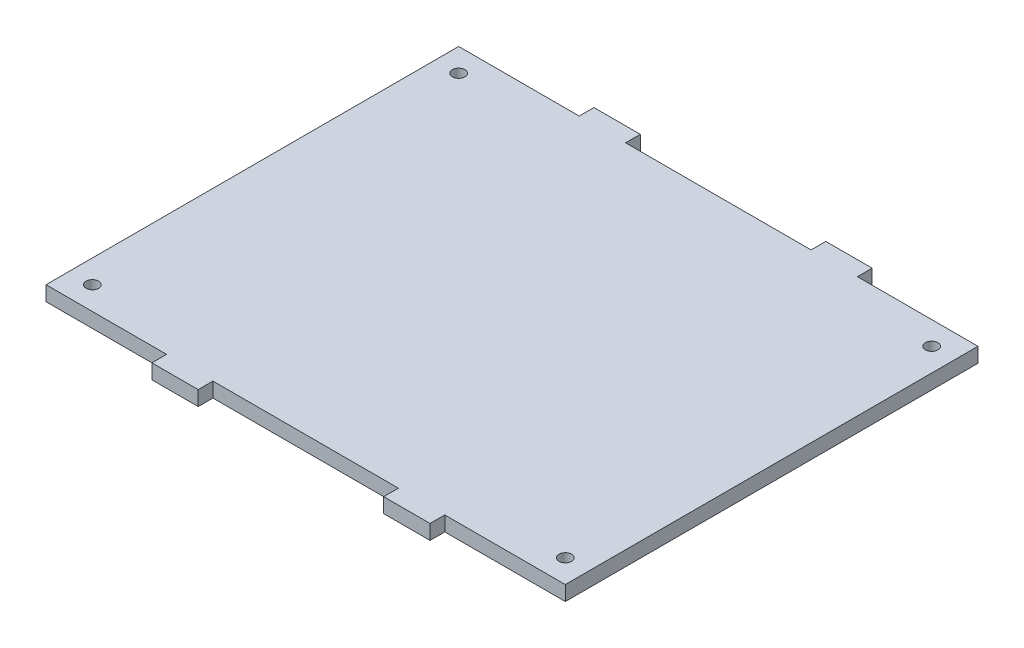
from build123d import *

# Parameters (mm, degrees)
SKETCH1_W           = 112
SKETCH1_H           = 95.35
BOSS_EXTRUDE1_DEPTH = 3.175
SKETCH2_W           = 40
SKETCH2_H           = 3.175
SKETCH2_W_2         = 26
CUT_EXTRUDE1_DEPTH  = 74.613763998
SKETCH3_R           = 1.35
CUT_EXTRUDE2_DEPTH  = 74.613763998


with BuildPart() as part:
    # Sketch1 → Boss-Extrude1 (new body)
    with BuildSketch(Plane(origin=(0, 0, 0), x_dir=(1, 0, 0), z_dir=(0, 1, 0))):
        Rectangle(SKETCH1_W, SKETCH1_H)
    extrude(amount=BOSS_EXTRUDE1_DEPTH)

    # Sketch2 → Cut-Extrude1 (cut, through all)
    with BuildSketch(Plane(origin=(0, 3.175, 0), x_dir=(1, 0, 0), z_dir=(0, 1, 0))):
        with Locations((0, 46.0875)):
            Rectangle(SKETCH2_W, SKETCH2_H)
        with Locations((43, 46.0875)):
            Rectangle(SKETCH2_W_2, SKETCH2_H)
        with Locations((-43, 46.0875)):
            Rectangle(SKETCH2_W_2, SKETCH2_H)
        with Locations((0, -46.0875)):
            Rectangle(SKETCH2_W, SKETCH2_H)
        with Locations((-43, -46.0875)):
            Rectangle(SKETCH2_W_2, SKETCH2_H)
        with Locations((43, -46.0875)):
            Rectangle(SKETCH2_W_2, SKETCH2_H)
    extrude(amount=-CUT_EXTRUDE1_DEPTH, mode=Mode.SUBTRACT)

    # Sketch3 → Cut-Extrude2 (cut, through all)
    with BuildSketch(Plane(origin=(0, 3.175, 0), x_dir=(1, 0, 0), z_dir=(0, 1, 0))):
        with Locations(Location((-51, 39.5, 0), (0, 0, 270))):
            Circle(SKETCH3_R)
        with Locations(Location((51, 39.5, 0), (0, 0, 270))):
            Circle(SKETCH3_R)
        with Locations(Location((-51, -39.5, 0), (0, 0, 270))):
            Circle(SKETCH3_R)
        with Locations(Location((51, -39.5, 0), (0, 0, 270))):
            Circle(SKETCH3_R)
    extrude(amount=-CUT_EXTRUDE2_DEPTH, mode=Mode.SUBTRACT)


solid = part.part
